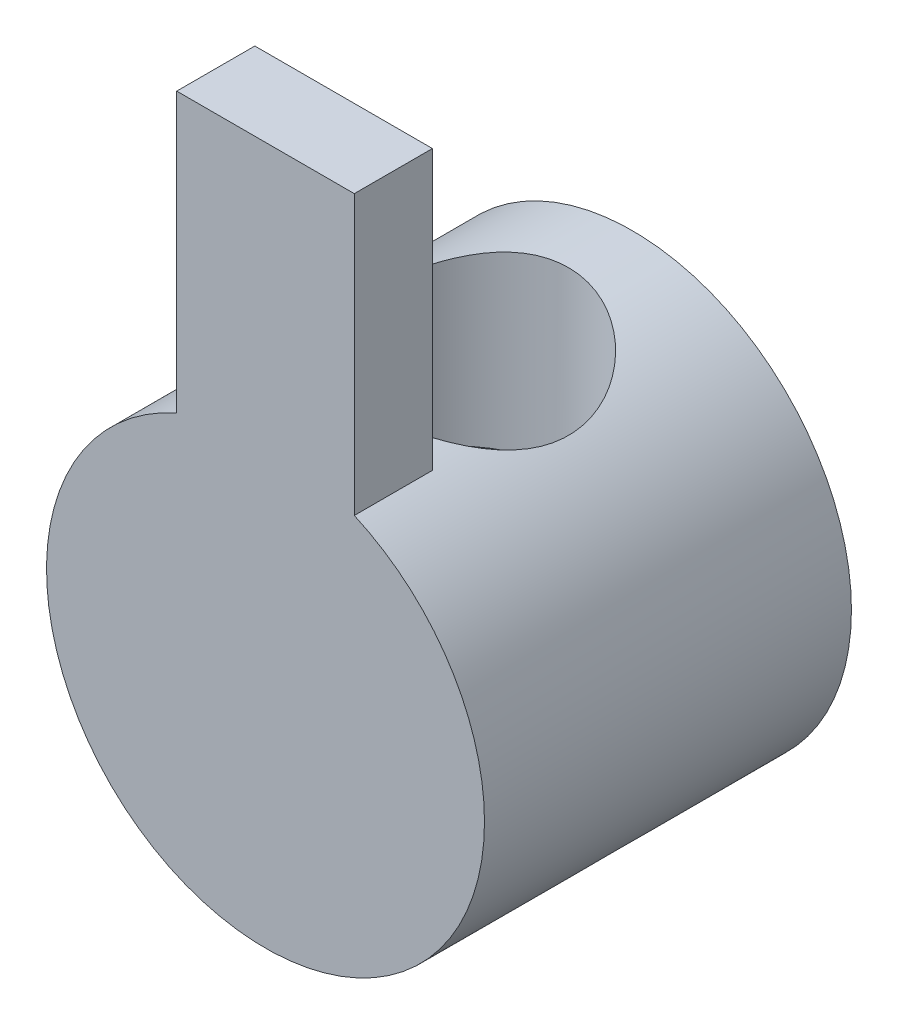
from build123d import *

# Parameters (mm, degrees)
SKETCH_1_W               = 7.5
SKETCH_1_H               = 30.5
EXTRUDE_1_DEPTH          = 3.3
SKETCH_4_W               = 7.5
SKETCH_4_H               = 8.198435562
CUT_EXTRUDE_1_DEPTH      = 17.047273912
SKETCH_2_R               = 9.25
EXTRUDE_2_DEPTH          = 15.5
SKETCH_5_R               = 4.8
CUT_EXTRUDE_2_DEPTH      = 34.218562582
CUT_EXTRUDE_3_DEPTH      = 2.75
CUT_EXTRUDE_3_DEPTH_BACK = 10
SKETCH_6_R               = 6.75
EXTRUDE_START            = -0.5
EXTRUDE_3_DEPTH          = 0.5


with BuildPart() as part:
    # 草图1 → 凸台-拉伸1 (new body)
    with BuildSketch(Plane.XY):
        Rectangle(SKETCH_1_W, SKETCH_1_H)
    extrude(amount=EXTRUDE_1_DEPTH)

    # 草图4 → 切除-拉伸1 (cut, through all)
    with BuildSketch(Plane(origin=(0, 0, 0), x_dir=(-1, 0, 0), z_dir=(0, 0, -1))):
        with Locations((0, -11.150782219)):
            Rectangle(SKETCH_4_W, SKETCH_4_H)
    extrude(amount=-CUT_EXTRUDE_1_DEPTH, mode=Mode.SUBTRACT)

    # 草图2 → 凸台-拉伸2 (add)
    with BuildSketch(Plane.XY.offset(3.3)):
        with Locations((0, -4.98)):
            Circle(SKETCH_2_R)
    extrude(amount=-EXTRUDE_2_DEPTH)

    # 草图5 → 切除-拉伸2 (cut, through all)
    with BuildSketch(Plane(origin=(0, 15.25, 0), x_dir=(1, 0, 0), z_dir=(0, 1, 0))):
        with Locations(Location((0, 4.7, 0), (0, 0, 270))):
            Circle(SKETCH_5_R)
    extrude(amount=-CUT_EXTRUDE_2_DEPTH, mode=Mode.SUBTRACT)

    # 草图6 → 切除-拉伸3 (cut, two sides: drawn at the far end of the back side and taken through both)
    with BuildSketch(Plane(origin=(0, -6, 0), x_dir=(1, 0, 0), z_dir=(0, 1, 0)).offset(-CUT_EXTRUDE_3_DEPTH_BACK)):
        with Locations(Location((0, 4.7, 0), (0, 0, 90))):
            Circle(SKETCH_6_R)
    extrude(amount=CUT_EXTRUDE_3_DEPTH + CUT_EXTRUDE_3_DEPTH_BACK, mode=Mode.SUBTRACT)

    # 草图7 → 凸台-拉伸3 (add)
    with BuildSketch(Plane(origin=(0, 0, 0), x_dir=(-1, 0, 0), z_dir=(0, 0, -1)).offset(EXTRUDE_START)):
        with BuildLine():
            Line((-0.974679434, 15.25), (-0.974679434, 4.218505313))
            ThreePointArc((-0.974679434, 4.218505313), (0, 4.27), (0.974679434, 4.218505313))
            Line((0.974679434, 4.218505313), (0.974679434, 15.25))
            Line((0.974679434, 15.25), (-0.974679434, 15.25))
        make_face()
    extrude(amount=EXTRUDE_3_DEPTH)


solid = part.part
